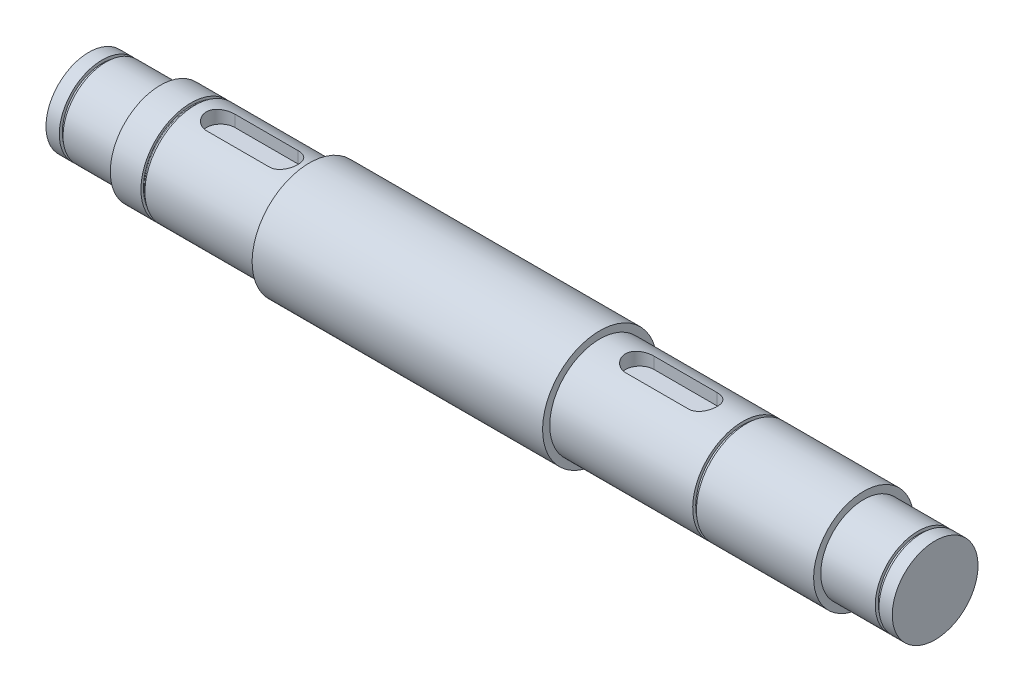
from build123d import *

# Parameters (mm, degrees)
CUT_EXTRUDE3_START = 21
CUT_EXTRUDE3_DEPTH = 6.2


with BuildPart() as part:
    # Sketch1 → Revolve1 (revolve)
    with BuildSketch(Plane.XY, mode=Mode.PRIVATE) as revolve1_sk:
        with BuildLine():
            Line((24.3, 17.078694854), (5.260372827, 17.078694854))
            Line((5.260372827, 17.078694854), (5.260372827, 16.028694854))
            Line((5.260372827, 16.028694854), (3.960372827, 16.028694854))
            Line((3.960372827, 16.028694854), (3.960372827, 17.078694854))
            Line((3.960372827, 17.078694854), (-0.7, 17.078694854))
            Line((-0.7, 17.078694854), (-0.7, 2.078694854))
            Line((-0.7, 2.078694854), (295.3, 2.078694854))
            Line((295.3, 2.078694854), (295.3, 17.078694854))
            Line((295.3, 17.078694854), (290.659722162, 17.078694854))
            Line((290.659722162, 17.078694854), (290.659722162, 16.028694854))
            Line((290.659722162, 16.028694854), (289.359722162, 16.028694854))
            Line((289.359722162, 16.028694854), (289.359722162, 17.078694854))
            Line((289.359722162, 17.078694854), (270.3, 17.078694854))
            Line((270.3, 17.078694854), (270.3, 19.578694854))
            Line((270.3, 19.578694854), (229.3, 19.578694854))
            Line((229.3, 19.578694854), (229.3, 18.528694854))
            Line((229.3, 18.528694854), (228, 18.528694854))
            Line((228, 18.528694854), (228, 19.578694854))
            Line((228, 19.578694854), (178, 19.578694854))
            Line((178, 19.578694854), (178, 22.078694854))
            Line((178, 22.078694854), (76.4, 22.078694854))
            Line((76.4, 22.078694854), (76.4, 19.578694854))
            Line((76.4, 19.578694854), (36.4, 19.578694854))
            Line((36.4, 19.578694854), (36.4, 18.728694854))
            ThreePointArc((36.4, 18.728694854), (36.341421356, 18.587273498), (36.2, 18.528694854))
            Line((36.2, 18.528694854), (35.2, 18.528694854))
            ThreePointArc((35.2, 18.528694854), (35.058578644, 18.587273498), (35, 18.728694854))
            Line((35, 18.728694854), (35, 19.578694854))
            Line((35, 19.578694854), (24.3, 19.578694854))
            Line((24.3, 19.578694854), (24.3, 17.078694854))
        make_face()
    revolve(revolve1_sk.sketch.rotate(Axis((-34.240282719, 2.078694854, 0), (1, 0, 0)), 180), axis=Axis((-34.240282719, 2.078694854, 0), (1, 0, 0)))

    # Sketch4 → Cut-Extrude3 (cut)
    with BuildSketch(Plane(origin=(0, 0, 0), x_dir=(1, 0, 0), z_dir=(0, 1, 0)).offset(CUT_EXTRUDE3_START)):
        with BuildLine():
            Line((45.4, 5), (67.4, 5))
            ThreePointArc((67.4, 5), (72.4, 0), (67.4, -5))
            Line((67.4, -5), (45.4, -5))
            ThreePointArc((45.4, -5), (40.4, 0), (45.4, 5))
        make_face()
        with BuildLine():
            Line((192, 5), (214, 5))
            ThreePointArc((214, 5), (219, 0), (214, -5))
            Line((214, -5), (192, -5))
            ThreePointArc((192, -5), (187, 0), (192, 5))
        make_face()
    extrude(amount=-CUT_EXTRUDE3_DEPTH, mode=Mode.SUBTRACT)


solid = part.part
